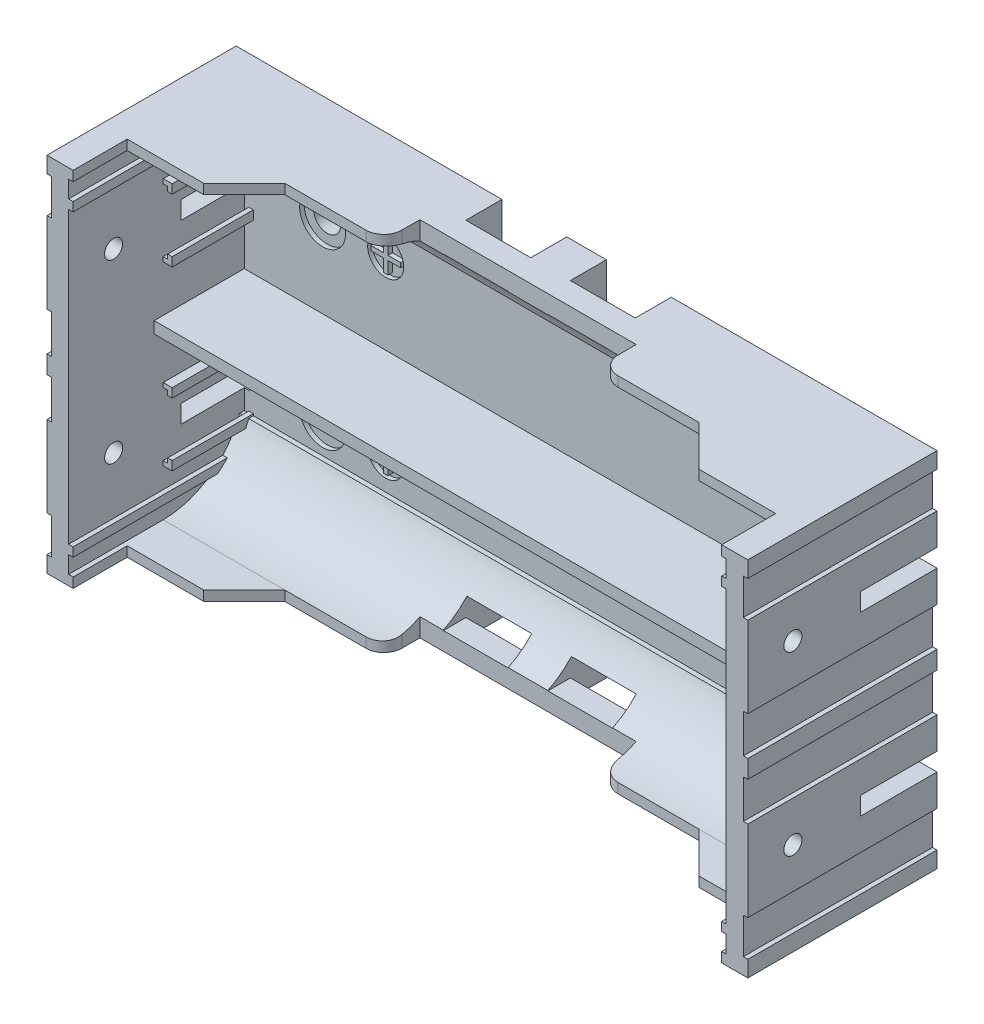
from build123d import *

# Parameters (mm, degrees)
SKETCH_1_R             = 1.6
SKETCH_1_R_2           = 1.5
EXTRUDE_450_DEPTH      = 1.5
EXTRUDE_1660_DEPTH     = 19.5
SKETCH_5_W             = 74
SKETCH_5_H             = 1.1
EXTRUDE_2071_DEPTH     = 13.5
EXTRUDE_5_DEPTH        = 74
CUT_EXTRUDE_2837_DEPTH = 45
SKETCH_3_R             = 2.55
SKETCH_3_R_2           = 2
CUT_EXTRUDE_1_DEPTH    = 0.5
EXTRUDE_3707_DEPTH     = 10
SKETCH_8_W             = 0.5
SKETCH_8_H             = 1.1
SKETCH_8_H_2           = 1
EXTRUDE_6_DEPTH        = 19.5
SKETCH_9_R             = 1
CUT_EXTRUDE_3_DEPTH    = 3
CUT_EXTRUDE_START      = -3
SKETCH_10_R            = 1
CUT_EXTRUDE_4_DEPTH    = 3
EXTRUDE_5932_DEPTH     = 9
SKETCH_12_W            = 7.2
SKETCH_12_H            = 4
CUT_EXTRUDE_5_DEPTH    = 4
SKETCH_13_W            = 7.2
SKETCH_13_H            = 2
CUT_EXTRUDE_6_DEPTH    = 4
EXTRUDE_START          = 0.4
SKETCH_14_R            = 2.9
SKETCH_14_R_2          = 1.5
EXTRUDE_7_DEPTH        = 0.4


with BuildPart() as part:
    # Эскиз1 → Extrude 450 (new body)
    with BuildSketch(Plane.XY):
        Polygon((-38.9, 20.1), (38.9, 20.1), (38.9, 18.3), (38.4, 18.3), (38.4, 14.3), (38.9, 14.3), (38.9, 5.3), (38.4, 5.3), (38.4, 1), (38.9, 1), (38.9, -1), (38.4, -1), (38.4, -5.3), (38.9, -5.3), (38.9, -14.3), (38.4, -14.3), (38.4, -18.3), (38.9, -18.3), (38.9, -20.1), (-38.9, -20.1), (-38.9, -18.3), (-38.4, -18.3), (-38.4, -14.3), (-38.9, -14.3), (-38.9, -5.3), (-38.4, -5.3), (-38.4, -1), (-38.9, -1), (-38.9, 1), (-38.4, 1), (-38.4, 5.3), (-38.9, 5.3), (-38.9, 14.3), (-38.4, 14.3), (-38.4, 18.3), (-38.9, 18.3), align=None)
        with Locations((27.8, 9.65)):
            Circle(SKETCH_1_R, mode=Mode.SUBTRACT)
        with Locations((-27.8, 9.65)):
            Circle(SKETCH_1_R_2, mode=Mode.SUBTRACT)
        with Locations((-27.8, -9.65)):
            Circle(SKETCH_1_R_2, mode=Mode.SUBTRACT)
        with Locations((27.8, -9.65)):
            Circle(SKETCH_1_R_2, mode=Mode.SUBTRACT)
    extrude(amount=EXTRUDE_450_DEPTH)

    # Эскиз2 → Extrude 1660 (add)
    with BuildSketch(Plane.XY.offset(1.5)):
        Polygon((38.9, 20.1), (36.5, 20.1), (36.5, -20.1), (38.9, -20.1), (38.9, -18.3), (38.4, -18.3), (38.4, -14.3), (38.9, -14.3), (38.9, -5.3), (38.4, -5.3), (38.4, -1), (38.9, -1), (38.9, 1), (38.4, 1), (38.4, 5.3), (38.9, 5.3), (38.9, 14.3), (38.4, 14.3), (38.4, 18.3), (38.9, 18.3), align=None)
        Polygon((-38.9, 20.1), (-36.5, 20.1), (-36.5, -20.1), (-38.9, -20.1), (-38.9, -18.3), (-38.4, -18.3), (-38.4, -14.3), (-38.9, -14.3), (-38.9, -5.3), (-38.4, -5.3), (-38.4, -1), (-38.9, -1), (-38.9, 1), (-38.4, 1), (-38.4, 5.3), (-38.9, 5.3), (-38.9, 14.3), (-38.4, 14.3), (-38.4, 18.3), (-38.9, 18.3), align=None)
    extrude(amount=EXTRUDE_1660_DEPTH)

    # Эскиз5 → Extrude 2071 (add)
    with BuildSketch(Plane.XY.offset(1.5)):
        with Locations((0, 19.55)):
            Rectangle(SKETCH_5_W, SKETCH_5_H)
        with Locations((0, -19.55)):
            Rectangle(SKETCH_5_W, SKETCH_5_H)
    extrude(amount=EXTRUDE_2071_DEPTH)

    # Эскиз7 → Бобышка-Вытянуть5 (add)
    with BuildSketch(Plane(origin=(-36.5, 0, 0), x_dir=(0, 0, -1), z_dir=(1, 0, 0))):
        with BuildLine():
            Line((-1.5, 19), (-10.5, 19))
            ThreePointArc((-10.5, 19), (-5.303847905, 17.348469069), (-2.014719179, 13))
            Line((-2.014719179, 13), (-1.5, 13))
            Line((-1.5, 13), (-1.5, 19))
        make_face()
        with BuildLine():
            Line((-1.5, -19), (-1.5, -13))
            Line((-1.5, -13), (-2.014718626, -13))
            ThreePointArc((-2.014718626, -13), (-5.303847577, -17.348469228), (-10.5, -19))
            Line((-10.5, -19), (-1.5, -19))
        make_face()
    extrude(amount=EXTRUDE_5_DEPTH)

    # Эскиз6 → Cut-Extrude 2837 (cut)
    with BuildSketch(Plane.XZ.offset(20.1)):
        with BuildLine():
            Line((-36.5, 15), (-27.5, 15))
            Line((-27.5, 15), (-23, 10.5))
            Line((-23, 10.5), (-14, 10.5))
            ThreePointArc((-14, 10.5), (-12.585786438, 9.914213562), (-12, 8.5))
            Line((-12, 8.5), (-12, 6.5))
            Line((-12, 6.5), (12, 6.5))
            Line((12, 6.5), (12, 8.5))
            ThreePointArc((12, 8.5), (12.585786438, 9.914213562), (14, 10.5))
            Line((14, 10.5), (23, 10.5))
            Line((23, 10.5), (27.5, 15))
            Line((27.5, 15), (36.5, 15))
            Line((36.5, 15), (36.5, 21))
            Line((36.5, 21), (-36.5, 21))
            Line((-36.5, 21), (-36.5, 15))
        make_face()
    extrude(amount=-CUT_EXTRUDE_2837_DEPTH, mode=Mode.SUBTRACT)

    # Эскиз3 → Вырез-Вытянуть1 (cut)
    # profile 1 of 8: a face of its own
    with BuildSketch(Plane.XY.offset(1.5)):
        with Locations((-27.8, 9.65)):
            Circle(SKETCH_3_R)
    # profile 2 of 8: a face of its own
    with BuildSketch(Plane.XY.offset(1.5)):
        with Locations((27.8, 9.65)):
            Circle(SKETCH_3_R)
    # profile 3 of 8: a face of its own
    with BuildSketch(Plane.XY.offset(1.5)):
        with Locations((-27.8, -9.65)):
            Circle(SKETCH_3_R)
    # profile 4 of 8: a face of its own
    with BuildSketch(Plane.XY.offset(1.5)):
        with Locations((27.8, -9.65)):
            Circle(SKETCH_3_R)
    # profile 5 of 8: a face of its own
    with BuildSketch(Plane.XY.offset(1.5)):
        with Locations((-20.8, 9.65)):
            Circle(SKETCH_3_R_2)
        Polygon((-20.55, 11.3), (-20.55, 9.9), (-19.15, 9.9), (-19.15, 9.4), (-20.55, 9.4), (-20.55, 8), (-21.05, 8), (-21.05, 9.4), (-22.45, 9.4), (-22.45, 9.9), (-21.05, 9.9), (-21.05, 11.3), align=None, mode=Mode.SUBTRACT)
    # profile 6 of 8: a face of its own
    with BuildSketch(Plane.XY.offset(1.5)):
        with Locations((-20.8, -9.65)):
            Circle(SKETCH_3_R_2)
        Polygon((-21.05, -8), (-20.55, -8), (-20.55, -9.4), (-19.15, -9.4), (-19.15, -9.9), (-20.55, -9.9), (-20.55, -11.3), (-21.05, -11.3), (-21.05, -9.9), (-22.45, -9.9), (-22.45, -9.4), (-21.05, -9.4), align=None, mode=Mode.SUBTRACT)
    # profile 7 of 8: a face of its own
    with BuildSketch(Plane.XY.offset(1.5)):
        with Locations((20.8, 9.65)):
            Circle(SKETCH_3_R_2)
        Polygon((20.8, 9.9), (19.15, 9.9), (19.15, 9.4), (22.45, 9.4), (22.45, 9.9), align=None, mode=Mode.SUBTRACT)
    # profile 8 of 8: a face of its own
    with BuildSketch(Plane.XY.offset(1.5)):
        with Locations((20.8, -9.65)):
            Circle(SKETCH_3_R_2)
        Polygon((20.8, -9.4), (19.15, -9.4), (19.15, -9.9), (22.45, -9.9), (22.45, -9.4), align=None, mode=Mode.SUBTRACT)
    extrude(amount=-CUT_EXTRUDE_1_DEPTH, mode=Mode.SUBTRACT)

    # Эскиз4 → Extrude 3707 (add)
    with BuildSketch(Plane.XY.offset(1.5)):
        Polygon((-37, 0), (-37, 0.65), (37, 0.65), (37, -0.65), (-37, -0.65), align=None)
    extrude(amount=EXTRUDE_3707_DEPTH)

    # Эскиз8 → Бобышка-Вытянуть6 (add)
    with BuildSketch(Plane.XY.offset(1.5)):
        with Locations((-36.25, 19.55)):
            Rectangle(SKETCH_8_W, SKETCH_8_H)
        with Locations((-36.25, -19.55)):
            Rectangle(SKETCH_8_W, SKETCH_8_H)
        with Locations((-36.25, 16.6)):
            Rectangle(SKETCH_8_W, SKETCH_8_H_2)
        with Locations((36.25, -19.55)):
            Rectangle(SKETCH_8_W, SKETCH_8_H)
        with Locations((-36.25, -16.6)):
            Rectangle(SKETCH_8_W, SKETCH_8_H_2)
        with Locations((36.25, -16.6)):
            Rectangle(SKETCH_8_W, SKETCH_8_H_2)
        with Locations((36.25, 19.55)):
            Rectangle(SKETCH_8_W, SKETCH_8_H)
        with Locations((36.25, 16.6)):
            Rectangle(SKETCH_8_W, SKETCH_8_H_2)
    extrude(amount=EXTRUDE_6_DEPTH)

    # Эскиз9 → Вырез-Вытянуть3 (cut)
    with BuildSketch(Plane(origin=(38.9, 0, 0), x_dir=(0, 0, -1), z_dir=(1, 0, 0))):
        with Locations((-16, 9.8)):
            Circle(SKETCH_9_R)
        with Locations((-16, -9.8)):
            Circle(SKETCH_9_R)
        Polygon((0, 9.8), (0, 10.8), (-8.5, 10.8), (-8.5, 8.8), (0, 8.8), align=None)
        Polygon((0, -9.8), (0, -8.8), (-8.5, -8.8), (-8.5, -10.8), (0, -10.8), align=None)
    extrude(amount=-CUT_EXTRUDE_3_DEPTH, mode=Mode.SUBTRACT)

    # Эскиз10 → Вырез-Вытянуть4 (cut)
    with BuildSketch(Plane.ZY.offset(38.9).offset(CUT_EXTRUDE_START)):
        with Locations(Location((16, 9.8, 0), (0, 0, 180))):
            Circle(SKETCH_10_R)
        with Locations(Location((16, -9.8, 0), (0, 0, 180))):
            Circle(SKETCH_10_R)
        Polygon((0, 9.8), (0, 10.8), (8.5, 10.8), (8.5, 8.8), (0, 8.8), align=None)
        Polygon((0, -9.8), (0, -8.8), (8.5, -8.8), (8.5, -10.8), (0, -10.8), align=None)
    extrude(amount=CUT_EXTRUDE_4_DEPTH, mode=Mode.SUBTRACT)

    # Эскиз11 → Extrude 5932 (add)
    with BuildSketch(Plane.XY.offset(1.5)):
        Polygon((-36, 12.8), (-35.5, 12.8), (-35.5, 13.8), (-36.5, 13.8), (-36.5, 13.3), (-36, 13.3), align=None)
        Polygon((-36.5, 6.3), (-36, 6.3), (-36, 6.8), (-35.5, 6.8), (-35.5, 5.8), (-36.5, 5.8), align=None)
        Polygon((-36.5, -6.3), (-36, -6.3), (-36, -6.8), (-35.5, -6.8), (-35.5, -5.8), (-36.5, -5.8), align=None)
        Polygon((-36.5, -13.3), (-36, -13.3), (-36, -12.8), (-35.5, -12.8), (-35.5, -13.8), (-36.5, -13.8), align=None)
        Polygon((35.5, 13.8), (35.5, 12.8), (36, 12.8), (36, 13.3), (36.5, 13.3), (36.5, 13.8), align=None)
        Polygon((36.5, 5.8), (35.5, 5.8), (35.5, 6.8), (36, 6.8), (36, 6.3), (36.5, 6.3), align=None)
        Polygon((35.5, -5.8), (36.5, -5.8), (36.5, -6.3), (36, -6.3), (36, -6.8), (35.5, -6.8), align=None)
        Polygon((36.5, -13.3), (36.5, -13.8), (35.5, -13.8), (35.5, -12.8), (36, -12.8), (36, -13.3), align=None)
    extrude(amount=EXTRUDE_5932_DEPTH)

    # Эскиз12 → Вырез-Вытянуть5 (cut)
    with BuildSketch(Plane(origin=(0, 0, 0), x_dir=(-1, 0, 0), z_dir=(0, 0, -1))):
        with Locations((-5.8, 18.1)):
            Rectangle(SKETCH_12_W, SKETCH_12_H)
        with Locations((5.8, 18.1)):
            Rectangle(SKETCH_12_W, SKETCH_12_H)
        with Locations((-5.8, -18.1)):
            Rectangle(SKETCH_12_W, SKETCH_12_H)
        with Locations((5.8, -18.1)):
            Rectangle(SKETCH_12_W, SKETCH_12_H)
    extrude(amount=-CUT_EXTRUDE_5_DEPTH, mode=Mode.SUBTRACT)

    # Эскиз13 → Вырез-Вытянуть6 (cut)
    with BuildSketch(Plane(origin=(0, 0, 4), x_dir=(-1, 0, 0), z_dir=(0, 0, -1))):
        with Locations((-5.8, 17.1)):
            Rectangle(SKETCH_13_W, SKETCH_13_H)
        with Locations((5.8, 17.1)):
            Rectangle(SKETCH_13_W, SKETCH_13_H)
        with Locations((-5.8, -17.1)):
            Rectangle(SKETCH_13_W, SKETCH_13_H)
        with Locations((5.8, -17.1)):
            Rectangle(SKETCH_13_W, SKETCH_13_H)
    extrude(amount=-CUT_EXTRUDE_6_DEPTH, mode=Mode.SUBTRACT)

    # Эскиз14 → Бобышка-Вытянуть7 (add)
    # profile 1 of 4: a face of its own
    with BuildSketch(Plane(origin=(0, 0, 0), x_dir=(-1, 0, 0), z_dir=(0, 0, -1)).offset(EXTRUDE_START)):
        with Locations(Location((-27.8, 9.65, 0), (0, 0, 180))):
            Circle(SKETCH_14_R)
        with Locations((-27.8, 9.65)):
            Circle(SKETCH_14_R_2, mode=Mode.SUBTRACT)
    # profile 2 of 4: a face of its own
    with BuildSketch(Plane(origin=(0, 0, 0), x_dir=(-1, 0, 0), z_dir=(0, 0, -1)).offset(EXTRUDE_START)):
        with Locations(Location((-27.8, -9.65, 0), (0, 0, 180))):
            Circle(SKETCH_14_R)
        with Locations((-27.8, -9.65)):
            Circle(SKETCH_14_R_2, mode=Mode.SUBTRACT)
    # profile 3 of 4: a face of its own
    with BuildSketch(Plane(origin=(0, 0, 0), x_dir=(-1, 0, 0), z_dir=(0, 0, -1)).offset(EXTRUDE_START)):
        with Locations(Location((27.8, 9.65, 0), (0, 0, 180))):
            Circle(SKETCH_14_R)
        with Locations((27.8, 9.65)):
            Circle(SKETCH_14_R_2, mode=Mode.SUBTRACT)
    # profile 4 of 4: a face of its own
    with BuildSketch(Plane(origin=(0, 0, 0), x_dir=(-1, 0, 0), z_dir=(0, 0, -1)).offset(EXTRUDE_START)):
        with Locations(Location((27.8, -9.65, 0), (0, 0, 180))):
            Circle(SKETCH_14_R)
        with Locations((27.8, -9.65)):
            Circle(SKETCH_14_R_2, mode=Mode.SUBTRACT)
    extrude(amount=-EXTRUDE_7_DEPTH)


solid = part.part
